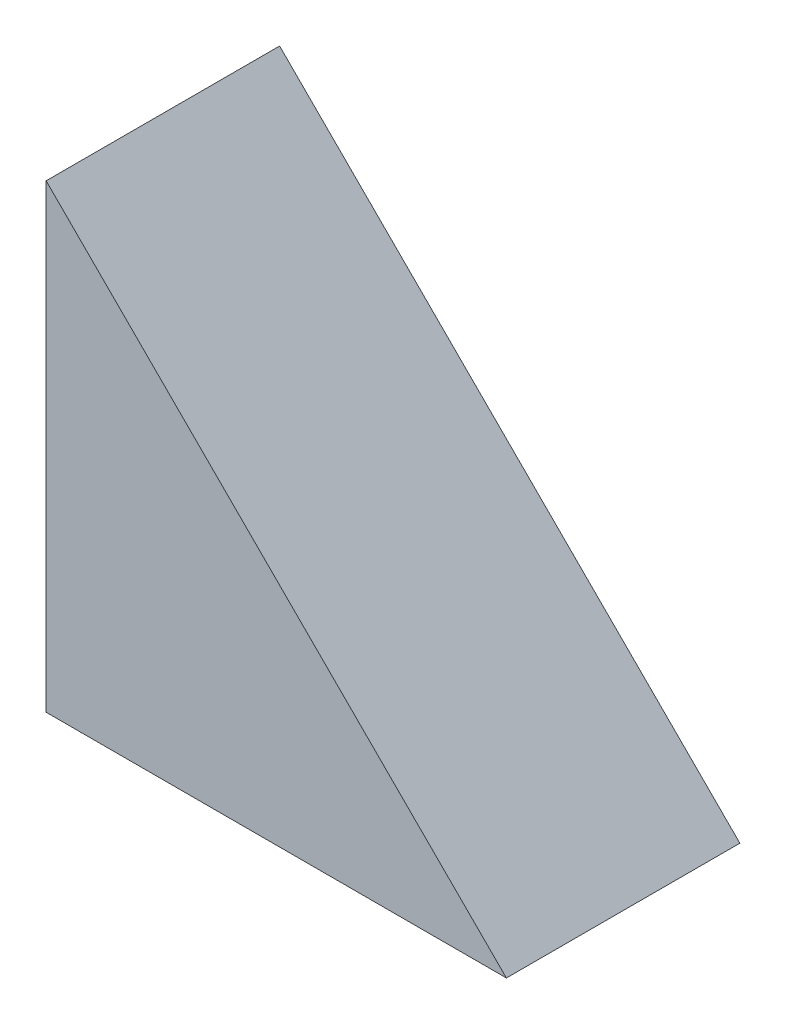
from build123d import *

# Parameters (mm, degrees)
BOSS_EXTRUDE1_DEPTH = 35


with BuildPart() as part:
    # Sketch1 → Boss-Extrude1 (new body)
    with BuildSketch(Plane.XY):
        Polygon((0, 0), (69, 0), (0, 69), align=None)
    extrude(amount=BOSS_EXTRUDE1_DEPTH)


solid = part.part
